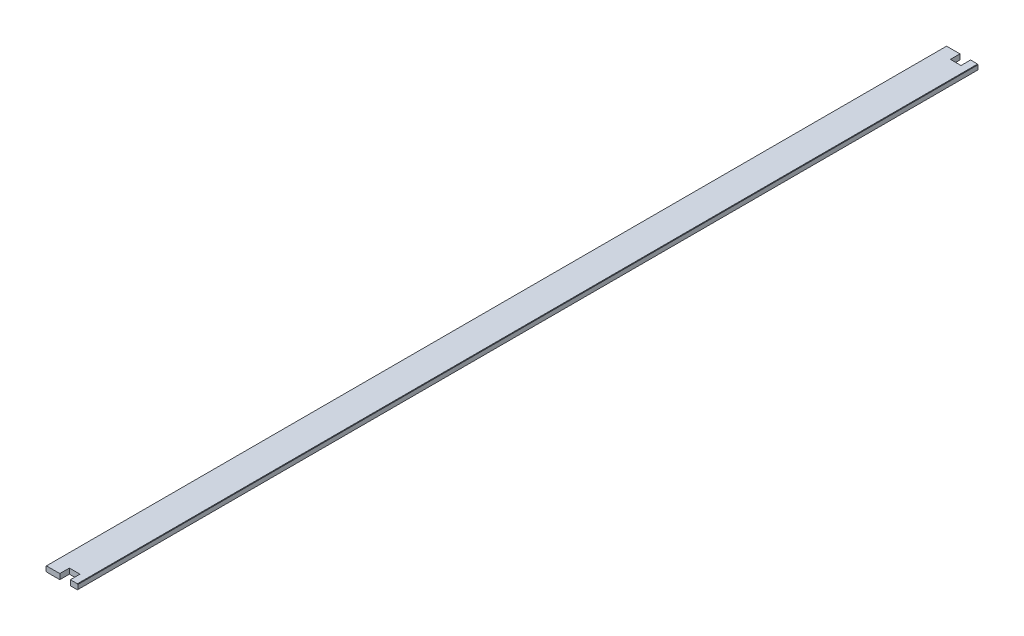
from build123d import *

# Parameters (mm, degrees)
EXTRUDE_1_DEPTH     = 4240
SKETCH_2_W          = 50
SKETCH_2_H          = 45
CUT_EXTRUDE_1_DEPTH = 4241.736964255


with BuildPart() as part:
    # Эскиз1 → Бобышка-Вытянуть1 (new body)
    with BuildSketch(Plane.XY):
        Polygon((-75, 10.5), (-73, 12.5), (73, 12.5), (75, 10.5), (75, -10.5), (73, -12.5), (-73, -12.5), (-75, -10.5), align=None)
    extrude(amount=EXTRUDE_1_DEPTH)

    # Эскиз2 → Вырез-Вытянуть1 (cut, through all)
    with BuildSketch(Plane(origin=(0, 12.5, 0), x_dir=(1, 0, 0), z_dir=(0, 1, 0))):
        with Locations((15, -22.5)):
            Rectangle(SKETCH_2_W, SKETCH_2_H)
        with Locations((15, -4217.5)):
            Rectangle(SKETCH_2_W, SKETCH_2_H)
    extrude(amount=-CUT_EXTRUDE_1_DEPTH, mode=Mode.SUBTRACT)


solid = part.part
